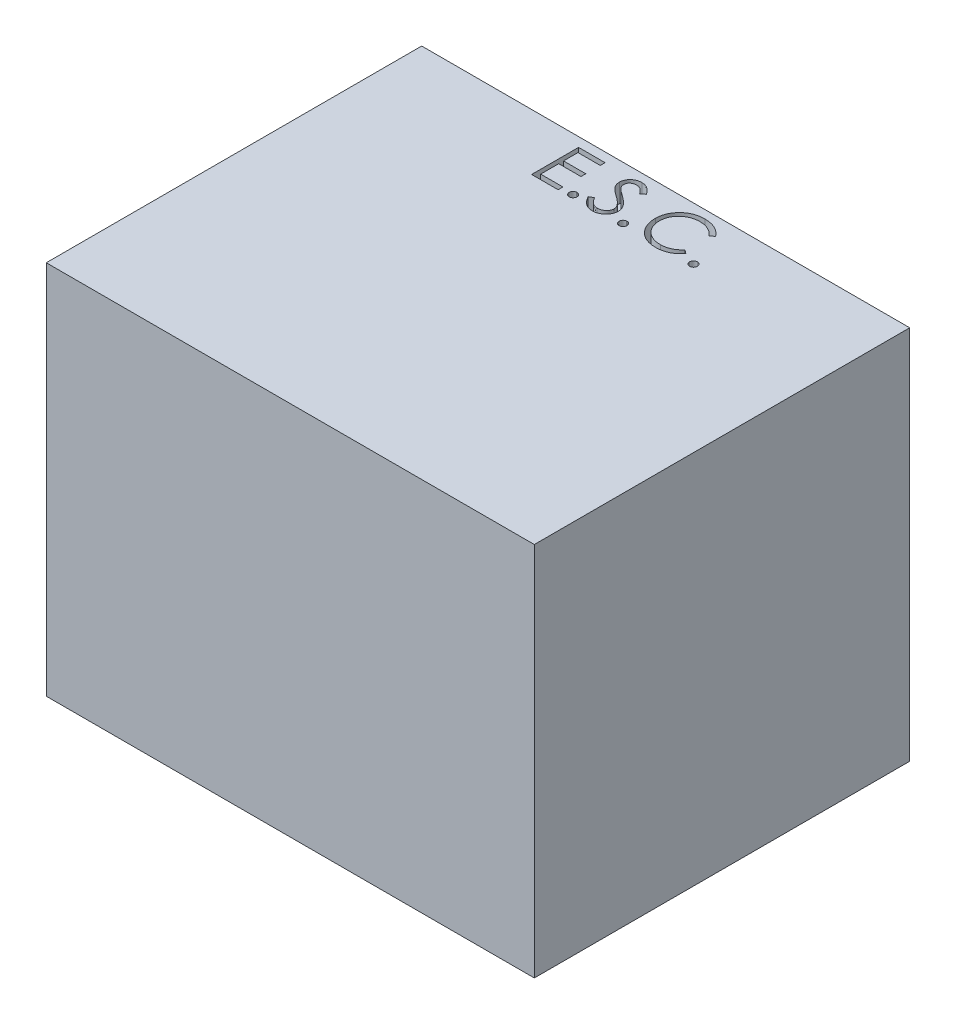
from build123d import *

# Parameters (mm, degrees)
SKETCH1_W      = 25.4
SKETCH1_H      = 25.4
EXTRUDE1_DEPTH = 16.51
EXTRUDE2_DEPTH = 1.27


with BuildPart() as part:
    # Sketch1 → Extrude1 (new, symmetric)
    with BuildSketch(Plane(origin=(0, 0, 0), x_dir=(0, 0, -1), z_dir=(1, 0, 0))):
        with Locations((12.7, 12.7)):
            Rectangle(SKETCH1_W, SKETCH1_H)
    extrude(amount=EXTRUDE1_DEPTH, both=True)

    # Sketch2 → Extrude2 (cut)
    with BuildSketch(Plane(origin=(0, 25.4, 0), x_dir=(1, 0, 0), z_dir=(0, 1, 0))):
        Polygon((-5.262964502, 24.767656182), (-3.47193886, 24.767656182), (-3.47193886, 24.442015156), (-4.978028604, 24.442015156), (-4.978028604, 23.465092079), (-3.47193886, 23.465092079), (-3.47193886, 23.139451054), (-4.978028604, 23.139451054), (-4.978028604, 21.918297208), (-3.47193886, 21.918297208), (-3.47193886, 21.592656182), (-5.262964502, 21.592656182), align=None)
        with BuildLine():
            add(Edge.make_bspline(
                [(-2.67818886, 22.08111772), (-2.660508454, 22.080067098), (-2.625848083, 22.078007475), (-2.575738303, 22.063877207), (-2.530386004, 22.03878685), (-2.489988896, 22.005347044), (-2.456690878, 21.964801693), (-2.430706359, 21.919811118), (-2.416699179, 21.869281816), (-2.414654559, 21.834420611), (-2.413605527, 21.816534387)],
                knots=[0, 0, 0, 0, 1.020151414, 1.999887582, 2.974338812, 3.990962822, 5.007586832, 5.987933904, 6.967670073, 8, 8, 8, 8], degree=3))
            add(Edge.make_bspline(
                [(-2.413605527, 21.816534387), (-2.414690108, 21.799077938), (-2.416828885, 21.764654077), (-2.430674251, 21.714505893), (-2.456888911, 21.669487201), (-2.489759226, 21.62839169), (-2.530395991, 21.594881043), (-2.575845523, 21.570004151), (-2.62573045, 21.554862141), (-2.660488829, 21.552933286), (-2.67818886, 21.551951054)],
                knots=[0, 0, 0, 0, 1.009421747, 1.99056486, 2.972319754, 3.999869655, 5.017953583, 5.993804169, 6.978383603, 8, 8, 8, 8], degree=3))
            add(Edge.make_bspline(
                [(-2.67818886, 21.551951054), (-2.695901646, 21.552897745), (-2.730481644, 21.554745936), (-2.780180367, 21.570315053), (-2.825906689, 21.594647763), (-2.866535542, 21.628454174), (-2.899681155, 21.669275733), (-2.924741324, 21.714815934), (-2.939790959, 21.764510523), (-2.941770229, 21.799049664), (-2.942772194, 21.816534387)],
                knots=[0, 0, 0, 0, 1.022052826, 1.995314843, 2.982371812, 4.00089066, 5.028879526, 6.005146991, 6.990147033, 8, 8, 8, 8], degree=3))
            add(Edge.make_bspline(
                [(-2.942772194, 21.816534387), (-2.941808718, 21.834449896), (-2.93992765, 21.869427728), (-2.92470973, 21.919501204), (-2.899875594, 21.965011145), (-2.866306415, 22.005285186), (-2.825916518, 22.039019382), (-2.780290674, 22.063571015), (-2.730361949, 22.078121961), (-2.695881504, 22.080101815), (-2.67818886, 22.08111772)],
                knots=[0, 0, 0, 0, 1.032775665, 2.016367738, 2.991239715, 4.008302682, 5.025365648, 6.011011707, 6.979408107, 8, 8, 8, 8], degree=3))
        make_face()
        with BuildLine():
            Line((-2.047259373, 22.205141158), (-1.778859934, 22.366053618))
            add(Edge.make_bspline(
                [(-1.778859934, 22.366053618), (-1.753896962, 22.32426664), (-1.70606887, 22.244204403), (-1.626284423, 22.136020324), (-1.543613853, 22.044070367), (-1.457444958, 21.968889445), (-1.368303705, 21.909699383), (-1.275608171, 21.867787359), (-1.179670728, 21.841647152), (-1.11438019, 21.838472074), (-1.081784614, 21.836886951)],
                knots=[0, 0, 0, 0, 1.272034388, 2.437168799, 3.508375237, 4.49857839, 5.41946034, 6.295179144, 7.148887113, 8, 8, 8, 8], degree=3))
            add(Edge.make_bspline(
                [(-1.081784614, 21.836886951), (-1.053947247, 21.837662261), (-0.998759603, 21.839199315), (-0.917513854, 21.853968328), (-0.838608934, 21.876657903), (-0.763671098, 21.909152605), (-0.693734362, 21.948466802), (-0.632405431, 21.995952264), (-0.579386457, 22.049116464), (-0.53601676, 22.108427873), (-0.502742728, 22.172215572), (-0.477168495, 22.23768947), (-0.462976178, 22.3058781), (-0.460838266, 22.35178902), (-0.459759373, 22.374957865)],
                knots=[0, 0, 0, 0, 1.095163259, 2.171163733, 3.241058638, 4.321873601, 5.38011039, 6.391990106, 7.366004449, 8.327778327, 9.272591725, 10.192022065, 11.087607919, 12, 12, 12, 12], degree=3))
            add(Edge.make_bspline(
                [(-0.459759373, 22.374957865), (-0.461096784, 22.401392778), (-0.463815544, 22.455131095), (-0.486794815, 22.534415066), (-0.522943775, 22.612876183), (-0.556292744, 22.661409474), (-0.573606529, 22.686606502)],
                knots=[0, 0, 0, 0, 0.938893495, 1.908633276, 2.914225137, 4, 4, 4, 4], degree=3))
            add(Edge.make_bspline(
                [(-0.573606529, 22.686606502), (-0.587822014, 22.704791835), (-0.617665649, 22.742969667), (-0.668971392, 22.799797845), (-0.729174939, 22.858415982), (-0.796216021, 22.921062412), (-0.872536751, 22.984823485), (-0.955746711, 23.052739708), (-1.047970354, 23.122228282), (-1.112649183, 23.168830538), (-1.146022394, 23.192876534)],
                knots=[0, 0, 0, 0, 0.722233717, 1.516239348, 2.393582979, 3.351407094, 4.387010283, 5.505090956, 6.712668013, 8, 8, 8, 8], degree=3))
            add(Edge.make_bspline(
                [(-1.146022394, 23.192876534), (-1.179427019, 23.21666961), (-1.243294119, 23.26216016), (-1.332610118, 23.329673617), (-1.412479024, 23.391399128), (-1.482545846, 23.447917767), (-1.542779766, 23.499237201), (-1.593655432, 23.544864618), (-1.633876837, 23.586033991), (-1.656242971, 23.612741494), (-1.666284814, 23.624732504)],
                knots=[0, 0, 0, 0, 1.452282411, 2.77665338, 3.964542531, 5.026858415, 5.96415736, 6.766646006, 7.446254459, 8, 8, 8, 8], degree=3))
            add(Edge.make_bspline(
                [(-1.666284814, 23.624732504), (-1.680320623, 23.643420587), (-1.707923925, 23.680173212), (-1.74436023, 23.737617904), (-1.775329327, 23.796421866), (-1.799606586, 23.856743115), (-1.820050156, 23.9177348), (-1.833800564, 23.980192716), (-1.842410617, 24.043836606), (-1.843292348, 24.086665995), (-1.843733732, 24.108105901)],
                knots=[0, 0, 0, 0, 1.068054152, 2.10047183, 3.106115577, 4.101338837, 5.06977816, 6.043150881, 7.020423561, 8, 8, 8, 8], degree=3))
            add(Edge.make_bspline(
                [(-1.843733732, 24.108105901), (-1.842549721, 24.141697197), (-1.840207007, 24.208161798), (-1.820394537, 24.305254051), (-1.789122698, 24.397951729), (-1.745312336, 24.485337104), (-1.688836023, 24.565134815), (-1.623480032, 24.638262764), (-1.545636755, 24.699738549), (-1.460226875, 24.753452345), (-1.366740023, 24.79549472), (-1.268776847, 24.827209323), (-1.166181646, 24.84517915), (-1.096691659, 24.847757944), (-1.06143205, 24.849066438)],
                knots=[0, 0, 0, 0, 1.005424448, 1.989358655, 2.955360095, 3.929531133, 4.905563448, 5.876582895, 6.856512386, 7.866279853, 8.892233794, 9.918561126, 10.94386622, 12, 12, 12, 12], degree=3))
            add(Edge.make_bspline(
                [(-1.06143205, 24.849066438), (-1.024017759, 24.847775981), (-0.949612675, 24.845209673), (-0.840166601, 24.822896198), (-0.734792237, 24.785974874), (-0.650025847, 24.744075163), (-0.583683985, 24.702227379), (-0.533090148, 24.664109395), (-0.481820747, 24.620226261), (-0.429462225, 24.570461088), (-0.37690177, 24.514357249), (-0.323359067, 24.452298981), (-0.268708909, 24.384665534), (-0.233551807, 24.336383309), (-0.215528604, 24.311631542)],
                knots=[0, 0, 0, 0, 1.286793592, 2.559021753, 3.825965368, 5.121522368, 5.803751409, 6.523245864, 7.299691795, 8.125521123, 9.008227632, 9.944561021, 10.946284179, 12, 12, 12, 12], degree=3))
            Line((-0.215528604, 24.311631542), (-0.473115743, 24.116374131))
            add(Edge.make_bspline(
                [(-0.473115743, 24.116374131), (-0.488669554, 24.136411728), (-0.518622555, 24.174999457), (-0.564097161, 24.22903915), (-0.606958435, 24.278402671), (-0.649186298, 24.321278894), (-0.68855052, 24.360015829), (-0.726756694, 24.393180752), (-0.763254999, 24.421098613), (-0.809262482, 24.450892414), (-0.867063555, 24.480425814), (-0.939620956, 24.505416763), (-1.015445648, 24.520434569), (-1.067088957, 24.522420203), (-1.093232931, 24.523425413)],
                knots=[0, 0, 0, 0, 1.181633172, 2.275549214, 3.290209073, 4.226197932, 5.078386478, 5.862611352, 6.581680152, 7.217281963, 8.414376989, 9.595101626, 10.782541182, 12, 12, 12, 12], degree=3))
            add(Edge.make_bspline(
                [(-1.093232931, 24.523425413), (-1.126032062, 24.522326228), (-1.189282096, 24.520206553), (-1.279080382, 24.497056281), (-1.3599013, 24.460605593), (-1.429345412, 24.409519863), (-1.487163956, 24.348994391), (-1.528988193, 24.279345001), (-1.554161557, 24.20243525), (-1.557233396, 24.148785319), (-1.558797835, 24.121462272)],
                knots=[0, 0, 0, 0, 1.14458467, 2.207223713, 3.21896685, 4.227309161, 5.202851033, 6.127160689, 7.046193047, 8, 8, 8, 8], degree=3))
            add(Edge.make_bspline(
                [(-1.558797835, 24.121462272), (-1.558441213, 24.104452002), (-1.557727386, 24.070403647), (-1.547771676, 24.020101286), (-1.534981571, 23.969925999), (-1.514713612, 23.92010337), (-1.486732515, 23.869762059), (-1.449988534, 23.818035197), (-1.403712172, 23.764466861), (-1.36826374, 23.729625887), (-1.349548035, 23.711230901)],
                knots=[0, 0, 0, 0, 0.858281714, 1.717966888, 2.583508476, 3.4729293, 4.427298488, 5.488583878, 6.674047936, 8, 8, 8, 8], degree=3))
            add(Edge.make_bspline(
                [(-1.349548035, 23.711230901), (-1.342598076, 23.705028742), (-1.326086564, 23.690293832), (-1.295900545, 23.666170834), (-1.25603815, 23.636414034), (-1.207540296, 23.59959554), (-1.14951276, 23.556885928), (-1.081949163, 23.508831294), (-1.00560263, 23.453871627), (-0.95142632, 23.415447287), (-0.922780207, 23.39513014)],
                knots=[0, 0, 0, 0, 0.420754252, 0.999615792, 1.744751191, 2.668019286, 3.750313428, 4.999500688, 6.413464383, 8, 8, 8, 8], degree=3))
            add(Edge.make_bspline(
                [(-0.922780207, 23.39513014), (-0.888321557, 23.370055478), (-0.821597157, 23.321501871), (-0.726657781, 23.248553361), (-0.640575541, 23.1772086), (-0.563048206, 23.107923199), (-0.493309868, 23.041222715), (-0.432134221, 22.976304687), (-0.378897925, 22.913634203), (-0.321585349, 22.833286224), (-0.263022184, 22.73460624), (-0.212728816, 22.613703838), (-0.181016601, 22.492331461), (-0.176869584, 22.410754974), (-0.174823476, 22.370505741)],
                knots=[0, 0, 0, 0, 1.163667725, 2.253281268, 3.268753668, 4.215851969, 5.092017293, 5.902905408, 6.650798638, 7.335211899, 8.59617414, 9.77448103, 10.901945474, 12, 12, 12, 12], degree=3))
            add(Edge.make_bspline(
                [(-0.174823476, 22.370505741), (-0.175419594, 22.342041081), (-0.176600254, 22.285664526), (-0.19017194, 22.202883135), (-0.210056208, 22.122482275), (-0.240025699, 22.045455766), (-0.276604564, 21.970394445), (-0.32301966, 21.899267278), (-0.376820203, 21.830500045), (-0.438536546, 21.76592645), (-0.506069615, 21.706648115), (-0.577446967, 21.653916752), (-0.652785428, 21.609949058), (-0.731676301, 21.574070795), (-0.814137707, 21.546009675), (-0.900141911, 21.525678001), (-0.989830682, 21.513199606), (-1.050791118, 21.511904423), (-1.081784614, 21.511245925)],
                knots=[0, 0, 0, 0, 0.983748083, 1.948392443, 2.894712957, 3.844097841, 4.80183111, 5.778335162, 6.776009319, 7.81870978, 8.863265674, 9.881300176, 10.883814829, 11.87499822, 12.874611388, 13.892143829, 14.928324115, 16, 16, 16, 16], degree=3))
            add(Edge.make_bspline(
                [(-1.081784614, 21.511245925), (-1.105765246, 21.51170964), (-1.1534245, 21.51263123), (-1.223918101, 21.520778534), (-1.292987586, 21.532305692), (-1.359766256, 21.550606456), (-1.425114479, 21.572810571), (-1.488748042, 21.600150344), (-1.550697784, 21.632913805), (-1.611310877, 21.670374292), (-1.670433164, 21.713969531), (-1.72751011, 21.764745489), (-1.784414442, 21.821301768), (-1.83946658, 21.885174208), (-1.893780076, 21.955330898), (-1.946284061, 22.032428228), (-1.998065334, 22.116046256), (-2.03055508, 22.174888155), (-2.047259373, 22.205141158)],
                knots=[0, 0, 0, 0, 0.915332311, 1.819136955, 2.706846663, 3.586547465, 4.459518054, 5.340707479, 6.227863349, 7.133153174, 8.059268498, 9.028702269, 10.047606654, 11.120612155, 12.245963614, 13.433783089, 14.680604001, 16, 16, 16, 16], degree=3))
        make_face()
        with BuildLine():
            add(Edge.make_bspline(
                [(0.700336781, 22.08111772), (0.718017187, 22.080067098), (0.752677558, 22.078007475), (0.802787338, 22.063877207), (0.848139637, 22.03878685), (0.888536745, 22.005347044), (0.921834763, 21.964801693), (0.947819282, 21.919811118), (0.961826462, 21.869281816), (0.963871082, 21.834420611), (0.964920114, 21.816534387)],
                knots=[0, 0, 0, 0, 1.020151414, 1.999887582, 2.974338812, 3.990962822, 5.007586832, 5.987933904, 6.967670073, 8, 8, 8, 8], degree=3))
            add(Edge.make_bspline(
                [(0.964920114, 21.816534387), (0.963835533, 21.799077938), (0.961696756, 21.764654077), (0.94785139, 21.714505893), (0.92163673, 21.669487201), (0.888766415, 21.62839169), (0.848129651, 21.594881043), (0.802680118, 21.570004151), (0.752795191, 21.554862141), (0.718036812, 21.552933286), (0.700336781, 21.551951054)],
                knots=[0, 0, 0, 0, 1.009421747, 1.99056486, 2.972319754, 3.999869655, 5.017953583, 5.993804169, 6.978383603, 8, 8, 8, 8], degree=3))
            add(Edge.make_bspline(
                [(0.700336781, 21.551951054), (0.682623995, 21.552897745), (0.648043997, 21.554745936), (0.598345274, 21.570315053), (0.552618952, 21.594647763), (0.511990099, 21.628454174), (0.478844486, 21.669275733), (0.453784317, 21.714815934), (0.438734682, 21.764510523), (0.436755412, 21.799049664), (0.435753447, 21.816534387)],
                knots=[0, 0, 0, 0, 1.022052826, 1.995314843, 2.982371812, 4.00089066, 5.028879526, 6.005146991, 6.990147033, 8, 8, 8, 8], degree=3))
            add(Edge.make_bspline(
                [(0.435753447, 21.816534387), (0.436716923, 21.834449896), (0.438597991, 21.869427728), (0.453815912, 21.919501204), (0.478650047, 21.965011145), (0.512219226, 22.005285186), (0.552609123, 22.039019382), (0.598234967, 22.063571015), (0.648163692, 22.078121961), (0.682644137, 22.080101815), (0.700336781, 22.08111772)],
                knots=[0, 0, 0, 0, 1.032775665, 2.016367738, 2.991239715, 4.008302682, 5.025365648, 6.011011707, 6.979408107, 8, 8, 8, 8], degree=3))
        make_face()
        with BuildLine():
            Line((4.587676524, 24.185064034), (4.338357614, 23.994258746))
            add(Edge.make_bspline(
                [(4.338357614, 23.994258746), (4.320572272, 24.015455019), (4.285241374, 24.057561792), (4.228400526, 24.11668895), (4.169162607, 24.172083866), (4.107550262, 24.224010428), (4.042454489, 24.27065278), (3.975452193, 24.314441566), (3.905422538, 24.353691586), (3.808583464, 24.401283009), (3.681902916, 24.450945592), (3.522431883, 24.492586381), (3.355961101, 24.519094162), (3.242388993, 24.521965125), (3.184621636, 24.523425413)],
                knots=[0, 0, 0, 0, 0.757959112, 1.505699292, 2.245454638, 2.979532153, 3.711538275, 4.438200793, 5.171680507, 5.909471876, 7.393775596, 8.890124382, 10.418191784, 12, 12, 12, 12], degree=3))
            add(Edge.make_bspline(
                [(3.184621636, 24.523425413), (3.152796072, 24.523058961), (3.089440314, 24.522329459), (2.995416342, 24.512705466), (2.903148074, 24.499178869), (2.81269553, 24.47910804), (2.724173846, 24.453732878), (2.63700431, 24.423411253), (2.55244898, 24.385896505), (2.46933815, 24.344432584), (2.389709865, 24.297599116), (2.314367072, 24.246514861), (2.243584558, 24.191751466), (2.177306332, 24.133103677), (2.115464636, 24.070835613), (2.058507575, 24.004283674), (2.006632239, 23.933660631), (1.958810366, 23.859897754), (1.915981672, 23.783209901), (1.880122424, 23.70331323), (1.848367778, 23.621575936), (1.823240608, 23.537074526), (1.803351939, 23.450403588), (1.789628987, 23.361330516), (1.780114445, 23.270041393), (1.779388571, 23.208165802), (1.779022678, 23.176976094)],
                knots=[0, 0, 0, 0, 1.054917814, 2.100044995, 3.131103042, 4.146048494, 5.169673617, 6.183595914, 7.203665975, 8.234915748, 9.262203917, 10.264457458, 11.251630812, 12.227803204, 13.197192746, 14.159520551, 15.12972552, 16.100847026, 17.073214652, 18.039054194, 19.002613845, 19.979014051, 20.95965708, 21.949030935, 22.966165397, 24, 24, 24, 24], degree=3))
            add(Edge.make_bspline(
                [(1.779022678, 23.176976094), (1.780167328, 23.130048396), (1.782414697, 23.037912087), (1.802415686, 22.902955891), (1.83280959, 22.773669279), (1.878362292, 22.650860422), (1.934531716, 22.533014983), (2.005507128, 22.422126881), (2.087709273, 22.316520426), (2.182301067, 22.218691466), (2.286083486, 22.129325444), (2.397433377, 22.050630273), (2.51607341, 21.985030344), (2.640693639, 21.930442164), (2.772253042, 21.888480704), (2.910515041, 21.858940392), (3.055178923, 21.8396707), (3.154029736, 21.837825854), (3.204338183, 21.836886951)],
                knots=[0, 0, 0, 0, 1.029171465, 2.020641659, 2.987623507, 3.938342917, 4.889210282, 5.84687017, 6.821220943, 7.821438502, 8.827599549, 9.822697543, 10.807740252, 11.797342354, 12.80366471, 13.83203677, 14.896651826, 16, 16, 16, 16], degree=3))
            add(Edge.make_bspline(
                [(3.204338183, 21.836886951), (3.259767051, 21.838418916), (3.368864322, 21.841434188), (3.528855318, 21.86697865), (3.682013476, 21.908396904), (3.828347037, 21.966361448), (3.967443466, 22.04171353), (4.099520437, 22.133060891), (4.224689433, 22.24127245), (4.299956239, 22.323897859), (4.338357614, 22.366053618)],
                knots=[0, 0, 0, 0, 1.028121516, 2.023589091, 2.998037872, 3.967518031, 4.937445131, 5.927275754, 6.942489185, 8, 8, 8, 8], degree=3))
            Line((4.338357614, 22.366053618), (4.587676524, 22.177156382))
            add(Edge.make_bspline(
                [(4.587676524, 22.177156382), (4.567612239, 22.151267929), (4.527579775, 22.099615028), (4.462757145, 22.02679712), (4.394469882, 21.958304173), (4.322210774, 21.894688403), (4.246811063, 21.834676852), (4.166916894, 21.779974476), (4.083578557, 21.729817746), (3.997078423, 21.683891893), (3.907508396, 21.643145533), (3.814975801, 21.608262472), (3.719879493, 21.578213465), (3.622215125, 21.553492065), (3.521780117, 21.534196153), (3.418936901, 21.521296877), (3.313463514, 21.512459569), (3.24230594, 21.511654102), (3.206246236, 21.511245925)],
                knots=[0, 0, 0, 0, 0.986787822, 1.968848986, 2.935600012, 3.899624008, 4.868462664, 5.837806735, 6.815139263, 7.798259679, 8.787526145, 9.778297419, 10.776456485, 11.791383307, 12.812564526, 13.85620153, 14.913611965, 16, 16, 16, 16], degree=3))
            add(Edge.make_bspline(
                [(3.206246236, 21.511245925), (3.172098052, 21.51148359), (3.104574247, 21.511953543), (3.00488038, 21.519566437), (2.907825546, 21.529952984), (2.813687135, 21.545592246), (2.721951429, 21.564047469), (2.633450042, 21.588786395), (2.547312101, 21.616498853), (2.463883678, 21.649069805), (2.383093807, 21.685823771), (2.305203064, 21.727363256), (2.230247272, 21.773338948), (2.157489497, 21.822737422), (2.088004546, 21.877145402), (2.021190277, 21.935807278), (1.956672031, 21.998525331), (1.916755309, 22.043750805), (1.896685939, 22.066489315)],
                knots=[0, 0, 0, 0, 1.114604814, 2.203992996, 3.262667896, 4.300477797, 5.318619304, 6.316056647, 7.298880507, 8.271930387, 9.238335007, 10.195173496, 11.151986948, 12.108099108, 13.064862484, 14.031167946, 15.010108607, 16, 16, 16, 16], degree=3))
            add(Edge.make_bspline(
                [(1.896685939, 22.066489315), (1.864540748, 22.105987393), (1.800638451, 22.184506695), (1.718881581, 22.311766121), (1.648897728, 22.44463371), (1.592313857, 22.583807503), (1.548079092, 22.728975204), (1.517434722, 22.880209992), (1.497521481, 23.037370626), (1.49524429, 23.144265427), (1.494086781, 23.198600693)],
                knots=[0, 0, 0, 0, 0.994628077, 1.977248131, 2.950237994, 3.925870899, 4.908910175, 5.911660606, 6.938484602, 8, 8, 8, 8], degree=3))
            add(Edge.make_bspline(
                [(1.494086781, 23.198600693), (1.495497563, 23.255710283), (1.49827319, 23.368069836), (1.52185509, 23.532964779), (1.559790713, 23.690944977), (1.613672176, 23.841715517), (1.681984887, 23.986069414), (1.766373316, 24.122903935), (1.86585708, 24.253094175), (1.979655945, 24.374664699), (2.104449171, 24.485825398), (2.238088381, 24.583621026), (2.380312004, 24.665007629), (2.529553198, 24.733039862), (2.686929495, 24.785331625), (2.852105123, 24.82193773), (3.02476971, 24.844722543), (3.142573481, 24.84760291), (3.20243013, 24.849066438)],
                knots=[0, 0, 0, 0, 1.032925535, 2.032216505, 3.007276963, 3.968222605, 4.92396291, 5.891752235, 6.871517503, 7.883894988, 8.900124299, 9.891468569, 10.874487609, 11.85992873, 12.854644235, 13.869047385, 14.917252991, 16, 16, 16, 16], degree=3))
            add(Edge.make_bspline(
                [(3.20243013, 24.849066438), (3.238910401, 24.84862907), (3.311119423, 24.847763344), (3.417937901, 24.839321343), (3.521934869, 24.825248286), (3.623181974, 24.806092994), (3.722171776, 24.78231921), (3.818147709, 24.751349082), (3.911672946, 24.715937372), (4.002157641, 24.67515362), (4.089167655, 24.629373076), (4.172675887, 24.579103189), (4.252019008, 24.52440628), (4.327755321, 24.465747542), (4.398617884, 24.401885992), (4.466618654, 24.334578173), (4.529448346, 24.261885347), (4.568231601, 24.210718014), (4.587676524, 24.185064034)],
                knots=[0, 0, 0, 0, 1.096760587, 2.17092713, 3.219439832, 4.250915756, 5.268269357, 6.278326846, 7.281116186, 8.274029601, 9.260640565, 10.235837813, 11.203064059, 12.156899882, 13.114053108, 14.069676657, 15.032185724, 16, 16, 16, 16], degree=3))
        make_face()
        with BuildLine():
            add(Edge.make_bspline(
                [(5.462836781, 22.08111772), (5.480517187, 22.080067098), (5.515177558, 22.078007475), (5.565287338, 22.063877207), (5.610639637, 22.03878685), (5.651036745, 22.005347044), (5.684334763, 21.964801693), (5.710319282, 21.919811118), (5.724326462, 21.869281816), (5.726371082, 21.834420611), (5.727420114, 21.816534387)],
                knots=[0, 0, 0, 0, 1.020151414, 1.999887582, 2.974338812, 3.990962822, 5.007586832, 5.987933904, 6.967670073, 8, 8, 8, 8], degree=3))
            add(Edge.make_bspline(
                [(5.727420114, 21.816534387), (5.726335533, 21.799077938), (5.724196756, 21.764654077), (5.71035139, 21.714505893), (5.68413673, 21.669487201), (5.651266415, 21.62839169), (5.610629651, 21.594881043), (5.565180118, 21.570004151), (5.515295191, 21.554862141), (5.480536812, 21.552933286), (5.462836781, 21.551951054)],
                knots=[0, 0, 0, 0, 1.009421747, 1.99056486, 2.972319754, 3.999869655, 5.017953583, 5.993804169, 6.978383603, 8, 8, 8, 8], degree=3))
            add(Edge.make_bspline(
                [(5.462836781, 21.551951054), (5.445123995, 21.552897745), (5.410543997, 21.554745936), (5.360845274, 21.570315053), (5.315118952, 21.594647763), (5.274490099, 21.628454174), (5.241344486, 21.669275733), (5.216284317, 21.714815934), (5.201234682, 21.764510523), (5.199255412, 21.799049664), (5.198253447, 21.816534387)],
                knots=[0, 0, 0, 0, 1.022052826, 1.995314843, 2.982371812, 4.00089066, 5.028879526, 6.005146991, 6.990147033, 8, 8, 8, 8], degree=3))
            add(Edge.make_bspline(
                [(5.198253447, 21.816534387), (5.199216923, 21.834449896), (5.201097991, 21.869427728), (5.216315912, 21.919501204), (5.241150047, 21.965011145), (5.274719226, 22.005285186), (5.315109123, 22.039019382), (5.360734967, 22.063571015), (5.410663692, 22.078121961), (5.445144137, 22.080101815), (5.462836781, 22.08111772)],
                knots=[0, 0, 0, 0, 1.032775665, 2.016367738, 2.991239715, 4.008302682, 5.025365648, 6.011011707, 6.979408107, 8, 8, 8, 8], degree=3))
        make_face()
    extrude(amount=-EXTRUDE2_DEPTH, mode=Mode.SUBTRACT)


solid = part.part
